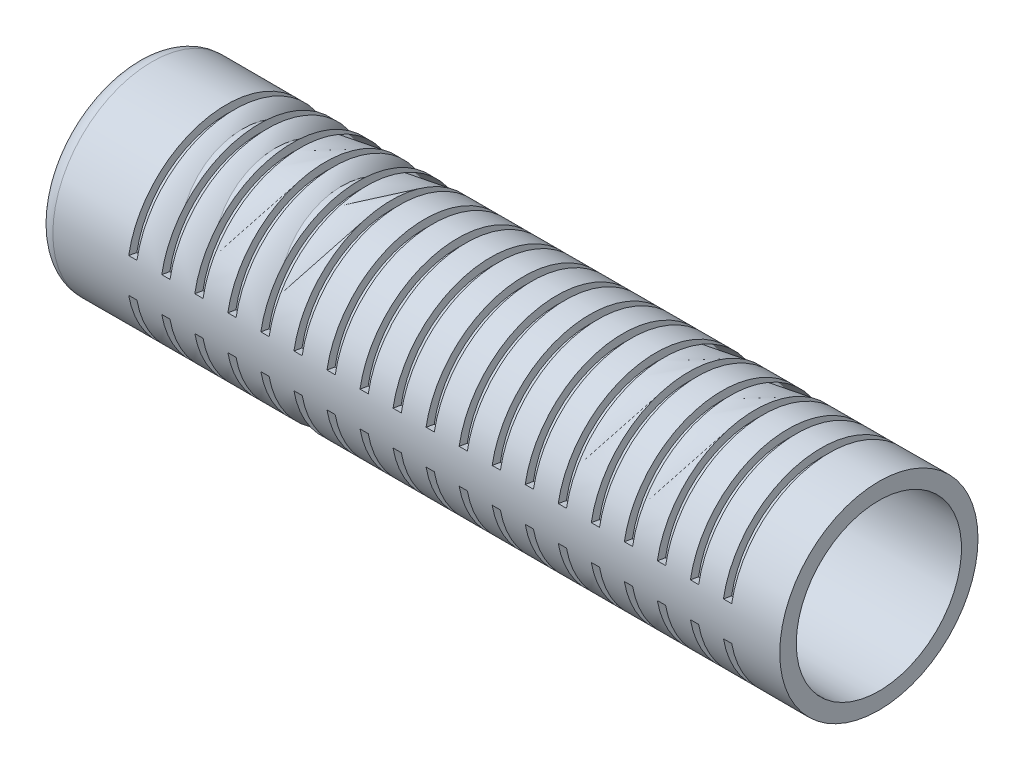
from build123d import *

# Parameters (mm, degrees)
SKETCH3_W                  = 1.27
SKETCH3_H                  = 1.27
LPATTERN2_COUNT            = 19
LPATTERN2_PITCH            = 5.08
LPATTERN2_COPY_1_SKETCH_W  = 1.27
LPATTERN2_COPY_1_SKETCH_H  = 1.27
LPATTERN2_COPY_2_SKETCH_W  = 1.27
LPATTERN2_COPY_2_SKETCH_H  = 1.27
LPATTERN2_COPY_3_SKETCH_W  = 1.27
LPATTERN2_COPY_3_SKETCH_H  = 1.27
LPATTERN2_COPY_4_SKETCH_W  = 1.27
LPATTERN2_COPY_4_SKETCH_H  = 1.27
LPATTERN2_COPY_5_SKETCH_W  = 1.27
LPATTERN2_COPY_5_SKETCH_H  = 1.27
LPATTERN2_COPY_6_SKETCH_W  = 1.27
LPATTERN2_COPY_6_SKETCH_H  = 1.27
LPATTERN2_COPY_7_SKETCH_W  = 1.27
LPATTERN2_COPY_7_SKETCH_H  = 1.27
LPATTERN2_COPY_8_SKETCH_W  = 1.27
LPATTERN2_COPY_8_SKETCH_H  = 1.27
LPATTERN2_COPY_9_SKETCH_W  = 1.27
LPATTERN2_COPY_9_SKETCH_H  = 1.27
LPATTERN2_COPY_10_SKETCH_W = 1.27
LPATTERN2_COPY_10_SKETCH_H = 1.27
LPATTERN2_COPY_11_SKETCH_W = 1.27
LPATTERN2_COPY_11_SKETCH_H = 1.27
LPATTERN2_COPY_12_SKETCH_W = 1.27
LPATTERN2_COPY_12_SKETCH_H = 1.27
LPATTERN2_COPY_13_SKETCH_W = 1.27
LPATTERN2_COPY_13_SKETCH_H = 1.27
LPATTERN2_COPY_14_SKETCH_W = 1.27
LPATTERN2_COPY_14_SKETCH_H = 1.27
LPATTERN2_COPY_15_SKETCH_W = 1.27
LPATTERN2_COPY_15_SKETCH_H = 1.27
LPATTERN2_COPY_16_SKETCH_W = 1.27
LPATTERN2_COPY_16_SKETCH_H = 1.27
LPATTERN2_COPY_17_SKETCH_W = 1.27
LPATTERN2_COPY_17_SKETCH_H = 1.27
LPATTERN2_COPY_18_SKETCH_W = 1.27
LPATTERN2_COPY_18_SKETCH_H = 1.27


with BuildPart() as part:
    # Sketch2 → Revolve1 (revolve)
    with BuildSketch(Plane.XY, mode=Mode.PRIVATE) as revolve1_sk:
        with BuildLine():
            Line((-57.15, 12.7), (-57.15, 2.54))
            Line((-57.15, 2.54), (-54.61, 2.54))
            Line((-54.61, 2.54), (-54.61, 10.16))
            ThreePointArc((-54.61, 10.16), (-53.866051224, 11.956051224), (-52.07, 12.7))
            Line((-52.07, 12.7), (57.15, 12.7))
            Line((57.15, 12.7), (57.15, 15.24))
            Line((57.15, 15.24), (-54.61, 15.24))
            ThreePointArc((-54.61, 15.24), (-56.406051224, 14.496051224), (-57.15, 12.7))
        make_face()
    revolve(revolve1_sk.sketch.rotate(Axis((-57.15, 0, 0), (1, 0, 0)), 90), axis=Axis((-57.15, 0, 0), (1, 0, 0)))

    # Cut-Sweep1: sweep along a path in Sketch7
    with BuildLine(Plane(origin=(0, 0, 0), x_dir=(0, 0, -1), z_dir=(1, 0, 0))) as cut_sweep1_path:
        ThreePointArc((-13.75776431, 2.425865042), (0, 13.97), (13.75776431, 2.425865042))
    # Sketch3 → Cut-Sweep1 (sweep, cut)
    with BuildSketch(Plane.XY):
        with Locations((48.895, 14.605)):
            Rectangle(SKETCH3_W, SKETCH3_H)
    cut_sweep1 = sweep(path=cut_sweep1_path.line, mode=Mode.SUBTRACT)

    # Mirror1: Cut-Sweep1 across plane
    add(cut_sweep1.mirror(Plane.ZX), mode=Mode.SUBTRACT)

    # LPattern2: Cut-Sweep1 ×19
    with Locations(*[(-i * LPATTERN2_PITCH, 0, 0) for i in range(1, LPATTERN2_COUNT)]):
        add(cut_sweep1, mode=Mode.SUBTRACT)

    # LPattern2 copy 1: sweep along a path in LPattern2 copy 1 path
    with BuildLine(Plane(origin=(-5.08, 0, 0), x_dir=(0, 0, -1), z_dir=(1, 0, 0))) as lpattern2_copy_1_path:
        ThreePointArc((-13.75776431, -2.425865042), (0, -13.97), (13.75776431, -2.425865042))
    # LPattern2 copy 1 sketch → LPattern2 copy 1 (sweep, cut)
    with BuildSketch(Plane(origin=(-5.08, 0, 0), x_dir=(1, 0, 0), z_dir=(0, 0, 1))):
        with Locations((48.895, -14.605)):
            Rectangle(LPATTERN2_COPY_1_SKETCH_W, LPATTERN2_COPY_1_SKETCH_H)
    sweep(path=lpattern2_copy_1_path.line, mode=Mode.SUBTRACT)

    # LPattern2 copy 2: sweep along a path in LPattern2 copy 2 path
    with BuildLine(Plane(origin=(-10.16, 0, 0), x_dir=(0, 0, -1), z_dir=(1, 0, 0))) as lpattern2_copy_2_path:
        ThreePointArc((-13.75776431, -2.425865042), (0, -13.97), (13.75776431, -2.425865042))
    # LPattern2 copy 2 sketch → LPattern2 copy 2 (sweep, cut)
    with BuildSketch(Plane(origin=(-10.16, 0, 0), x_dir=(1, 0, 0), z_dir=(0, 0, 1))):
        with Locations((48.895, -14.605)):
            Rectangle(LPATTERN2_COPY_2_SKETCH_W, LPATTERN2_COPY_2_SKETCH_H)
    sweep(path=lpattern2_copy_2_path.line, mode=Mode.SUBTRACT)

    # LPattern2 copy 3: sweep along a path in LPattern2 copy 3 path
    with BuildLine(Plane(origin=(-15.24, 0, 0), x_dir=(0, 0, -1), z_dir=(1, 0, 0))) as lpattern2_copy_3_path:
        ThreePointArc((-13.75776431, -2.425865042), (0, -13.97), (13.75776431, -2.425865042))
    # LPattern2 copy 3 sketch → LPattern2 copy 3 (sweep, cut)
    with BuildSketch(Plane(origin=(-15.24, 0, 0), x_dir=(1, 0, 0), z_dir=(0, 0, 1))):
        with Locations((48.895, -14.605)):
            Rectangle(LPATTERN2_COPY_3_SKETCH_W, LPATTERN2_COPY_3_SKETCH_H)
    sweep(path=lpattern2_copy_3_path.line, mode=Mode.SUBTRACT)

    # LPattern2 copy 4: sweep along a path in LPattern2 copy 4 path
    with BuildLine(Plane(origin=(-20.32, 0, 0), x_dir=(0, 0, -1), z_dir=(1, 0, 0))) as lpattern2_copy_4_path:
        ThreePointArc((-13.75776431, -2.425865042), (0, -13.97), (13.75776431, -2.425865042))
    # LPattern2 copy 4 sketch → LPattern2 copy 4 (sweep, cut)
    with BuildSketch(Plane(origin=(-20.32, 0, 0), x_dir=(1, 0, 0), z_dir=(0, 0, 1))):
        with Locations((48.895, -14.605)):
            Rectangle(LPATTERN2_COPY_4_SKETCH_W, LPATTERN2_COPY_4_SKETCH_H)
    sweep(path=lpattern2_copy_4_path.line, mode=Mode.SUBTRACT)

    # LPattern2 copy 5: sweep along a path in LPattern2 copy 5 path
    with BuildLine(Plane(origin=(-25.4, 0, 0), x_dir=(0, 0, -1), z_dir=(1, 0, 0))) as lpattern2_copy_5_path:
        ThreePointArc((-13.75776431, -2.425865042), (0, -13.97), (13.75776431, -2.425865042))
    # LPattern2 copy 5 sketch → LPattern2 copy 5 (sweep, cut)
    with BuildSketch(Plane(origin=(-25.4, 0, 0), x_dir=(1, 0, 0), z_dir=(0, 0, 1))):
        with Locations((48.895, -14.605)):
            Rectangle(LPATTERN2_COPY_5_SKETCH_W, LPATTERN2_COPY_5_SKETCH_H)
    sweep(path=lpattern2_copy_5_path.line, mode=Mode.SUBTRACT)

    # LPattern2 copy 6: sweep along a path in LPattern2 copy 6 path
    with BuildLine(Plane(origin=(-30.48, 0, 0), x_dir=(0, 0, -1), z_dir=(1, 0, 0))) as lpattern2_copy_6_path:
        ThreePointArc((-13.75776431, -2.425865042), (0, -13.97), (13.75776431, -2.425865042))
    # LPattern2 copy 6 sketch → LPattern2 copy 6 (sweep, cut)
    with BuildSketch(Plane(origin=(-30.48, 0, 0), x_dir=(1, 0, 0), z_dir=(0, 0, 1))):
        with Locations((48.895, -14.605)):
            Rectangle(LPATTERN2_COPY_6_SKETCH_W, LPATTERN2_COPY_6_SKETCH_H)
    sweep(path=lpattern2_copy_6_path.line, mode=Mode.SUBTRACT)

    # LPattern2 copy 7: sweep along a path in LPattern2 copy 7 path
    with BuildLine(Plane(origin=(-35.56, 0, 0), x_dir=(0, 0, -1), z_dir=(1, 0, 0))) as lpattern2_copy_7_path:
        ThreePointArc((-13.75776431, -2.425865042), (0, -13.97), (13.75776431, -2.425865042))
    # LPattern2 copy 7 sketch → LPattern2 copy 7 (sweep, cut)
    with BuildSketch(Plane(origin=(-35.56, 0, 0), x_dir=(1, 0, 0), z_dir=(0, 0, 1))):
        with Locations((48.895, -14.605)):
            Rectangle(LPATTERN2_COPY_7_SKETCH_W, LPATTERN2_COPY_7_SKETCH_H)
    sweep(path=lpattern2_copy_7_path.line, mode=Mode.SUBTRACT)

    # LPattern2 copy 8: sweep along a path in LPattern2 copy 8 path
    with BuildLine(Plane(origin=(-40.64, 0, 0), x_dir=(0, 0, -1), z_dir=(1, 0, 0))) as lpattern2_copy_8_path:
        ThreePointArc((-13.75776431, -2.425865042), (0, -13.97), (13.75776431, -2.425865042))
    # LPattern2 copy 8 sketch → LPattern2 copy 8 (sweep, cut)
    with BuildSketch(Plane(origin=(-40.64, 0, 0), x_dir=(1, 0, 0), z_dir=(0, 0, 1))):
        with Locations((48.895, -14.605)):
            Rectangle(LPATTERN2_COPY_8_SKETCH_W, LPATTERN2_COPY_8_SKETCH_H)
    sweep(path=lpattern2_copy_8_path.line, mode=Mode.SUBTRACT)

    # LPattern2 copy 9: sweep along a path in LPattern2 copy 9 path
    with BuildLine(Plane(origin=(-45.72, 0, 0), x_dir=(0, 0, -1), z_dir=(1, 0, 0))) as lpattern2_copy_9_path:
        ThreePointArc((-13.75776431, -2.425865042), (0, -13.97), (13.75776431, -2.425865042))
    # LPattern2 copy 9 sketch → LPattern2 copy 9 (sweep, cut)
    with BuildSketch(Plane(origin=(-45.72, 0, 0), x_dir=(1, 0, 0), z_dir=(0, 0, 1))):
        with Locations((48.895, -14.605)):
            Rectangle(LPATTERN2_COPY_9_SKETCH_W, LPATTERN2_COPY_9_SKETCH_H)
    sweep(path=lpattern2_copy_9_path.line, mode=Mode.SUBTRACT)

    # LPattern2 copy 10: sweep along a path in LPattern2 copy 10 path
    with BuildLine(Plane(origin=(-50.8, 0, 0), x_dir=(0, 0, -1), z_dir=(1, 0, 0))) as lpattern2_copy_10_path:
        ThreePointArc((-13.75776431, -2.425865042), (0, -13.97), (13.75776431, -2.425865042))
    # LPattern2 copy 10 sketch → LPattern2 copy 10 (sweep, cut)
    with BuildSketch(Plane(origin=(-50.8, 0, 0), x_dir=(1, 0, 0), z_dir=(0, 0, 1))):
        with Locations((48.895, -14.605)):
            Rectangle(LPATTERN2_COPY_10_SKETCH_W, LPATTERN2_COPY_10_SKETCH_H)
    sweep(path=lpattern2_copy_10_path.line, mode=Mode.SUBTRACT)

    # LPattern2 copy 11: sweep along a path in LPattern2 copy 11 path
    with BuildLine(Plane(origin=(-55.88, 0, 0), x_dir=(0, 0, -1), z_dir=(1, 0, 0))) as lpattern2_copy_11_path:
        ThreePointArc((-13.75776431, -2.425865042), (0, -13.97), (13.75776431, -2.425865042))
    # LPattern2 copy 11 sketch → LPattern2 copy 11 (sweep, cut)
    with BuildSketch(Plane(origin=(-55.88, 0, 0), x_dir=(1, 0, 0), z_dir=(0, 0, 1))):
        with Locations((48.895, -14.605)):
            Rectangle(LPATTERN2_COPY_11_SKETCH_W, LPATTERN2_COPY_11_SKETCH_H)
    sweep(path=lpattern2_copy_11_path.line, mode=Mode.SUBTRACT)

    # LPattern2 copy 12: sweep along a path in LPattern2 copy 12 path
    with BuildLine(Plane(origin=(-60.96, 0, 0), x_dir=(0, 0, -1), z_dir=(1, 0, 0))) as lpattern2_copy_12_path:
        ThreePointArc((-13.75776431, -2.425865042), (0, -13.97), (13.75776431, -2.425865042))
    # LPattern2 copy 12 sketch → LPattern2 copy 12 (sweep, cut)
    with BuildSketch(Plane(origin=(-60.96, 0, 0), x_dir=(1, 0, 0), z_dir=(0, 0, 1))):
        with Locations((48.895, -14.605)):
            Rectangle(LPATTERN2_COPY_12_SKETCH_W, LPATTERN2_COPY_12_SKETCH_H)
    sweep(path=lpattern2_copy_12_path.line, mode=Mode.SUBTRACT)

    # LPattern2 copy 13: sweep along a path in LPattern2 copy 13 path
    with BuildLine(Plane(origin=(-66.04, 0, 0), x_dir=(0, 0, -1), z_dir=(1, 0, 0))) as lpattern2_copy_13_path:
        ThreePointArc((-13.75776431, -2.425865042), (0, -13.97), (13.75776431, -2.425865042))
    # LPattern2 copy 13 sketch → LPattern2 copy 13 (sweep, cut)
    with BuildSketch(Plane(origin=(-66.04, 0, 0), x_dir=(1, 0, 0), z_dir=(0, 0, 1))):
        with Locations((48.895, -14.605)):
            Rectangle(LPATTERN2_COPY_13_SKETCH_W, LPATTERN2_COPY_13_SKETCH_H)
    sweep(path=lpattern2_copy_13_path.line, mode=Mode.SUBTRACT)

    # LPattern2 copy 14: sweep along a path in LPattern2 copy 14 path
    with BuildLine(Plane(origin=(-71.12, 0, 0), x_dir=(0, 0, -1), z_dir=(1, 0, 0))) as lpattern2_copy_14_path:
        ThreePointArc((-13.75776431, -2.425865042), (0, -13.97), (13.75776431, -2.425865042))
    # LPattern2 copy 14 sketch → LPattern2 copy 14 (sweep, cut)
    with BuildSketch(Plane(origin=(-71.12, 0, 0), x_dir=(1, 0, 0), z_dir=(0, 0, 1))):
        with Locations((48.895, -14.605)):
            Rectangle(LPATTERN2_COPY_14_SKETCH_W, LPATTERN2_COPY_14_SKETCH_H)
    sweep(path=lpattern2_copy_14_path.line, mode=Mode.SUBTRACT)

    # LPattern2 copy 15: sweep along a path in LPattern2 copy 15 path
    with BuildLine(Plane(origin=(-76.2, 0, 0), x_dir=(0, 0, -1), z_dir=(1, 0, 0))) as lpattern2_copy_15_path:
        ThreePointArc((-13.75776431, -2.425865042), (0, -13.97), (13.75776431, -2.425865042))
    # LPattern2 copy 15 sketch → LPattern2 copy 15 (sweep, cut)
    with BuildSketch(Plane(origin=(-76.2, 0, 0), x_dir=(1, 0, 0), z_dir=(0, 0, 1))):
        with Locations((48.895, -14.605)):
            Rectangle(LPATTERN2_COPY_15_SKETCH_W, LPATTERN2_COPY_15_SKETCH_H)
    sweep(path=lpattern2_copy_15_path.line, mode=Mode.SUBTRACT)

    # LPattern2 copy 16: sweep along a path in LPattern2 copy 16 path
    with BuildLine(Plane(origin=(-81.28, 0, 0), x_dir=(0, 0, -1), z_dir=(1, 0, 0))) as lpattern2_copy_16_path:
        ThreePointArc((-13.75776431, -2.425865042), (0, -13.97), (13.75776431, -2.425865042))
    # LPattern2 copy 16 sketch → LPattern2 copy 16 (sweep, cut)
    with BuildSketch(Plane(origin=(-81.28, 0, 0), x_dir=(1, 0, 0), z_dir=(0, 0, 1))):
        with Locations((48.895, -14.605)):
            Rectangle(LPATTERN2_COPY_16_SKETCH_W, LPATTERN2_COPY_16_SKETCH_H)
    sweep(path=lpattern2_copy_16_path.line, mode=Mode.SUBTRACT)

    # LPattern2 copy 17: sweep along a path in LPattern2 copy 17 path
    with BuildLine(Plane(origin=(-86.36, 0, 0), x_dir=(0, 0, -1), z_dir=(1, 0, 0))) as lpattern2_copy_17_path:
        ThreePointArc((-13.75776431, -2.425865042), (0, -13.97), (13.75776431, -2.425865042))
    # LPattern2 copy 17 sketch → LPattern2 copy 17 (sweep, cut)
    with BuildSketch(Plane(origin=(-86.36, 0, 0), x_dir=(1, 0, 0), z_dir=(0, 0, 1))):
        with Locations((48.895, -14.605)):
            Rectangle(LPATTERN2_COPY_17_SKETCH_W, LPATTERN2_COPY_17_SKETCH_H)
    sweep(path=lpattern2_copy_17_path.line, mode=Mode.SUBTRACT)

    # LPattern2 copy 18: sweep along a path in LPattern2 copy 18 path
    with BuildLine(Plane(origin=(-91.44, 0, 0), x_dir=(0, 0, -1), z_dir=(1, 0, 0))) as lpattern2_copy_18_path:
        ThreePointArc((-13.75776431, -2.425865042), (0, -13.97), (13.75776431, -2.425865042))
    # LPattern2 copy 18 sketch → LPattern2 copy 18 (sweep, cut)
    with BuildSketch(Plane(origin=(-91.44, 0, 0), x_dir=(1, 0, 0), z_dir=(0, 0, 1))):
        with Locations((48.895, -14.605)):
            Rectangle(LPATTERN2_COPY_18_SKETCH_W, LPATTERN2_COPY_18_SKETCH_H)
    sweep(path=lpattern2_copy_18_path.line, mode=Mode.SUBTRACT)


solid = part.part
